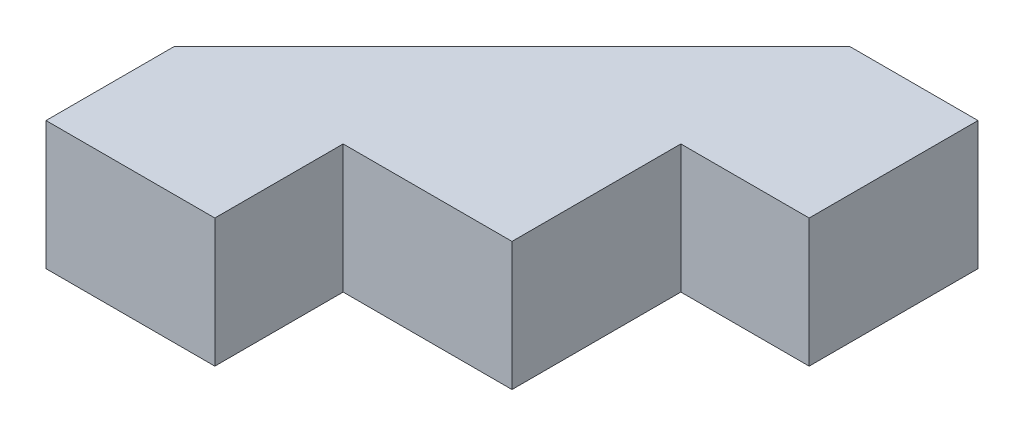
from build123d import *

# Parameters (mm, degrees)
SKETCH1_W           = 6.35
SKETCH1_H           = 4.826
SKETCH1_W_2         = 4.826
SKETCH1_H_2         = 6.35
BOSS_EXTRUDE1_DEPTH = 4.826


with BuildPart() as part:
    # Sketch1 → Boss-Extrude1 (new body)
    with BuildSketch(Plane(origin=(0, 0, 0), x_dir=(1, 0, 0), z_dir=(0, 1, 0))):
        with Locations((-5.186985437, -16.035114223)):
            Rectangle(SKETCH1_W, SKETCH1_H)
        Polygon((4.338014563, -0.922114223), (4.338014563, -13.622114223), (-8.361985437, -13.622114223), align=None)
        with Locations((6.751014563, -4.097114223)):
            Rectangle(SKETCH1_W_2, SKETCH1_H_2)
    extrude(amount=BOSS_EXTRUDE1_DEPTH)


solid = part.part
